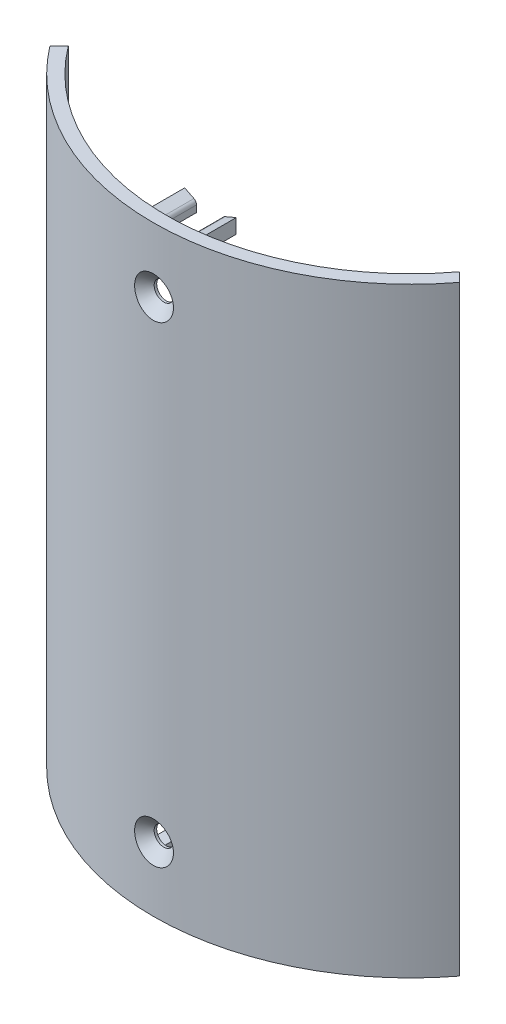
from build123d import *

# Parameters (mm, degrees)
BOSS_EXTRUDE1_DEPTH                                 = 70
BOSS_EXTRUDE2_REACH                                 = 115.806
BOSS_EXTRUDE2_START_RADIUS                          = 57
BOSS_EXTRUDE2_END_RADIUS                            = 57
SKETCH7_W                                           = 3
SKETCH7_H                                           = 10
CSK_FOR_M4_COUNTERSUNK_FLAT_HEAD_SCREW2_D           = 4.5
CSK_FOR_M4_COUNTERSUNK_FLAT_HEAD_SCREW2_DEPTH       = 11.5
CSK_FOR_M4_COUNTERSUNK_FLAT_HEAD_SCREW2_CSINK_D     = 9.4
CSK_FOR_M4_COUNTERSUNK_FLAT_HEAD_SCREW2_CSINK_ANGLE = 90
CSK_FOR_M4_COUNTERSUNK_FLAT_HEAD_SCREW2_TIP         = 1.351936393


with BuildPart() as part:
    # Sketch2 → Boss-Extrude1 (new, symmetric)
    with BuildSketch(Plane(origin=(0, 0, 0), x_dir=(1, 0, 0), z_dir=(0, 1, 0))):
        with BuildLine():
            Line((-47.704446333, -36.390737834), (-45.562994128, -34.249285629))
            ThreePointArc((-45.562994128, -34.249285629), (0, -57), (45.562994128, -34.249285629))
            Line((45.562994128, -34.249285629), (47.704446333, -36.390737834))
            ThreePointArc((47.704446333, -36.390737834), (0, -60), (-47.704446333, -36.390737834))
        make_face()
    extrude(amount=BOSS_EXTRUDE1_DEPTH, both=True)

    # Boss-Extrude2: from a cylinder face, 115.806 long prism both ways, kept between that surface and its translate by the depth
    boss_extrude2_start = Plane(origin=(0, 0.207736, 0), z_dir=(0, -1, 0)) * Cylinder(BOSS_EXTRUDE2_START_RADIUS, 477.027472, mode=Mode.PRIVATE)
    boss_extrude2_end = Plane(origin=(0, 0.207736, -10), z_dir=(0, -1, 0)) * Cylinder(BOSS_EXTRUDE2_END_RADIUS, 477.027472, mode=Mode.PRIVATE)
    # Sketch7 → Boss-Extrude2 (add, from a surface)
    with BuildSketch(Plane.XY, mode=Mode.PRIVATE) as boss_extrude2_sk1:
        with Locations((4.5, -65)):
            Rectangle(SKETCH7_W, SKETCH7_H)
    boss_extrude2_tool1 = extrude(boss_extrude2_sk1.sketch, amount=BOSS_EXTRUDE2_REACH, both=True, mode=Mode.PRIVATE)
    add(((boss_extrude2_tool1 & boss_extrude2_start) - boss_extrude2_end).solids().sort_by_distance((4.5, -65, 51.802164))[0])
    # Sketch7 → Boss-Extrude2 (add, from a surface)
    with BuildSketch(Plane.XY, mode=Mode.PRIVATE) as boss_extrude2_sk2:
        with BuildLine():
            Line((3, 65.553629026), (3, 64))
            Line((3, 64), (6, 64))
            Line((6, 64), (6, 67.370437785))
            Line((6, 67.370437785), (3.649292783, 66.490114182))
            ThreePointArc((3.649292783, 66.490114182), (3.178200993, 66.123406518), (3, 65.553629026))
        make_face()
    boss_extrude2_tool2 = extrude(boss_extrude2_sk2.sketch, amount=BOSS_EXTRUDE2_REACH, both=True, mode=Mode.PRIVATE)
    add(((boss_extrude2_tool2 & boss_extrude2_start) - boss_extrude2_end).solids().sort_by_distance((4.5, -65, 51.802164))[0])
    # Sketch7 → Boss-Extrude2 (add, from a surface)
    with BuildSketch(Plane.XY, mode=Mode.PRIVATE) as boss_extrude2_sk3:
        with BuildLine():
            Line((-3, 65.553629026), (-3, 64))
            Line((-3, 64), (-6, 64))
            Line((-6, 64), (-6, 67.370437785))
            Line((-6, 67.370437785), (-3.649292783, 66.490114182))
            ThreePointArc((-3.649292783, 66.490114182), (-3.178200993, 66.123406518), (-3, 65.553629026))
        make_face()
    boss_extrude2_tool3 = extrude(boss_extrude2_sk3.sketch, amount=BOSS_EXTRUDE2_REACH, both=True, mode=Mode.PRIVATE)
    add(((boss_extrude2_tool3 & boss_extrude2_start) - boss_extrude2_end).solids().sort_by_distance((4.5, -65, 51.802164))[0])
    # Sketch7 → Boss-Extrude2 (add, from a surface)
    with BuildSketch(Plane.XY, mode=Mode.PRIVATE) as boss_extrude2_sk4:
        with Locations((-4.5, -65)):
            Rectangle(SKETCH7_W, SKETCH7_H)
    boss_extrude2_tool4 = extrude(boss_extrude2_sk4.sketch, amount=BOSS_EXTRUDE2_REACH, both=True, mode=Mode.PRIVATE)
    add(((boss_extrude2_tool4 & boss_extrude2_start) - boss_extrude2_end).solids().sort_by_distance((4.5, -65, 51.802164))[0])

    # CSK for M4 Countersunk Flat Head Screw2
    with Locations(Plane(origin=(0, 55, 60), x_dir=(1, 0, 0), z_dir=(0, 0, 1))):
        with Locations((0, 0), (0, -110)):
            CounterSinkHole(CSK_FOR_M4_COUNTERSUNK_FLAT_HEAD_SCREW2_D / 2, CSK_FOR_M4_COUNTERSUNK_FLAT_HEAD_SCREW2_CSINK_D / 2, depth=CSK_FOR_M4_COUNTERSUNK_FLAT_HEAD_SCREW2_DEPTH, counter_sink_angle=CSK_FOR_M4_COUNTERSUNK_FLAT_HEAD_SCREW2_CSINK_ANGLE)
            with Locations((0, 0, -(CSK_FOR_M4_COUNTERSUNK_FLAT_HEAD_SCREW2_DEPTH + CSK_FOR_M4_COUNTERSUNK_FLAT_HEAD_SCREW2_TIP / 2))):  # 118° drill point
                Cone(0, CSK_FOR_M4_COUNTERSUNK_FLAT_HEAD_SCREW2_D / 2, CSK_FOR_M4_COUNTERSUNK_FLAT_HEAD_SCREW2_TIP, mode=Mode.SUBTRACT)


solid = part.part
